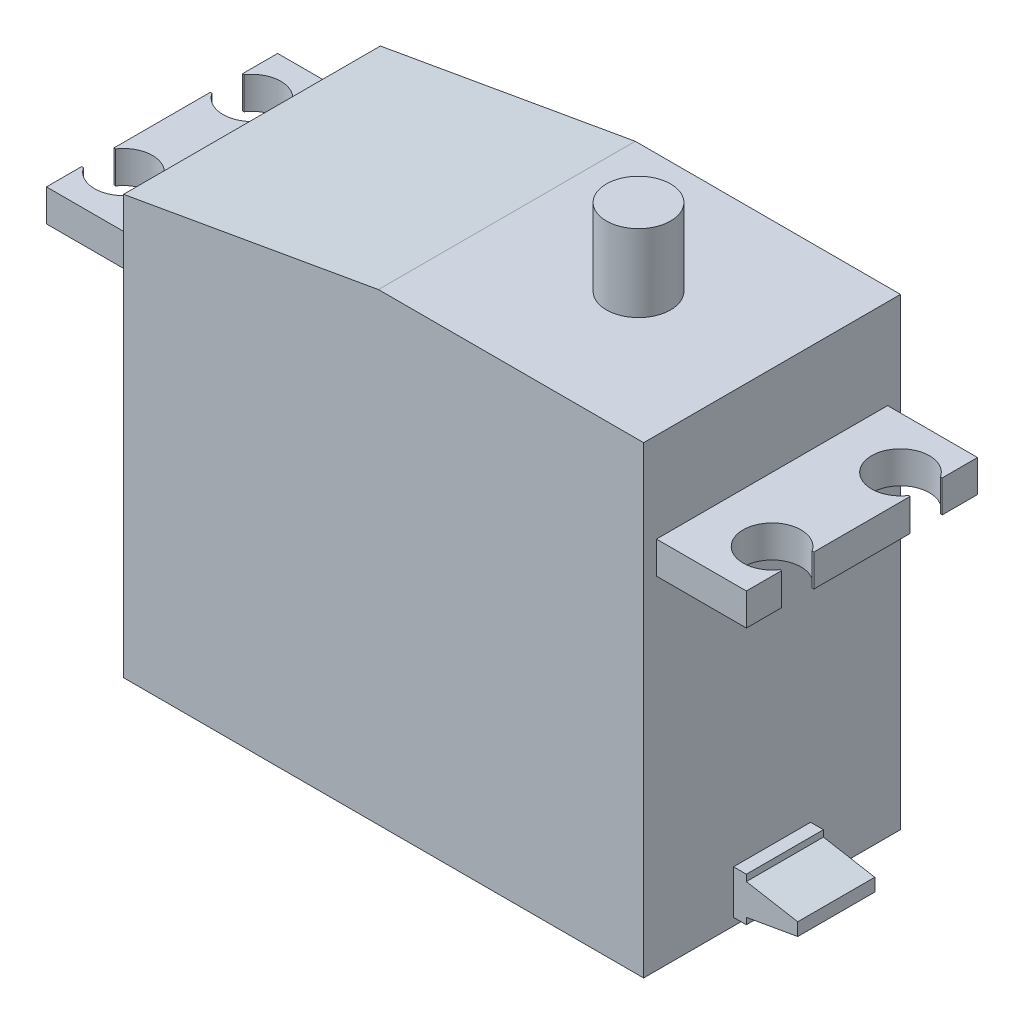
from build123d import *

# Parameters (mm, degrees)
SKETCH1_W           = 40.5
SKETCH1_H           = 36.1
BOSS_EXTRUDE1_DEPTH = 20
BOSS_EXTRUDE2_START = -1
SKETCH2_W           = 7
SKETCH2_H           = 2.5
BOSS_EXTRUDE2_DEPTH = 18
CUT_EXTRUDE1_REACH  = 61.187
SKETCH4_R           = 2.5
BOSS_EXTRUDE3_DEPTH = 6
BOSS_EXTRUDE4_START = -7
BOSS_EXTRUDE4_DEPTH = 6
CUT_EXTRUDE2_REACH  = 68.548


with BuildPart() as part:
    # Sketch1 → Boss-Extrude1 (new body)
    with BuildSketch(Plane.XY):
        with Locations((20.25, 18.05)):
            Rectangle(SKETCH1_W, SKETCH1_H)
    extrude(amount=BOSS_EXTRUDE1_DEPTH)

    # Sketch2 → Boss-Extrude2 (add)
    with BuildSketch(Plane.XY.offset(20).offset(BOSS_EXTRUDE2_START)):
        with Locations((-3.5, 27.85)):
            Rectangle(SKETCH2_W, SKETCH2_H)
        with Locations((44, 27.85)):
            Rectangle(SKETCH2_W, SKETCH2_H)
    extrude(amount=-BOSS_EXTRUDE2_DEPTH)

    # Sketch3 → Cut-Extrude1 (cut, up to next)
    with BuildSketch(Plane(origin=(0, 29.1, 0), x_dir=(1, 0, 0), z_dir=(0, 1, 0)), mode=Mode.PRIVATE) as cut_extrude1_sk1:
        with BuildLine():
            Line((-6.870828693, -3.75), (-7, -3.75))
            Line((-7, -3.75), (-7, -6.25))
            Line((-7, -6.25), (-6.870828693, -6.25))
            ThreePointArc((-6.870828693, -6.25), (-2.75, -5), (-6.870828693, -3.75))
        make_face()
    cut_extrude1_tool1 = extrude(cut_extrude1_sk1.sketch, amount=-CUT_EXTRUDE1_REACH, mode=Mode.PRIVATE) & part.part
    # Sketch3 → Cut-Extrude1 (cut, up to next)
    with BuildSketch(Plane(origin=(0, 29.1, 0), x_dir=(1, 0, 0), z_dir=(0, 1, 0)), mode=Mode.PRIVATE) as cut_extrude1_sk2:
        with BuildLine():
            Line((-7, -13.75), (-6.870828693, -13.75))
            ThreePointArc((-6.870828693, -13.75), (-2.75, -15), (-6.870828693, -16.25))
            Line((-6.870828693, -16.25), (-7, -16.25))
            Line((-7, -16.25), (-7, -13.75))
        make_face()
    cut_extrude1_tool2 = extrude(cut_extrude1_sk2.sketch, amount=-CUT_EXTRUDE1_REACH, mode=Mode.PRIVATE) & part.part
    # Sketch3 → Cut-Extrude1 (cut, up to next)
    with BuildSketch(Plane(origin=(0, 29.1, 0), x_dir=(1, 0, 0), z_dir=(0, 1, 0)), mode=Mode.PRIVATE) as cut_extrude1_sk3:
        with BuildLine():
            Line((47.370828693, -16.25), (47.5, -16.25))
            Line((47.5, -16.25), (47.5, -13.75))
            Line((47.5, -13.75), (47.370828693, -13.75))
            ThreePointArc((47.370828693, -13.75), (43.25, -15), (47.370828693, -16.25))
        make_face()
    cut_extrude1_tool3 = extrude(cut_extrude1_sk3.sketch, amount=-CUT_EXTRUDE1_REACH, mode=Mode.PRIVATE) & part.part
    # Sketch3 → Cut-Extrude1 (cut, up to next)
    with BuildSketch(Plane(origin=(0, 29.1, 0), x_dir=(1, 0, 0), z_dir=(0, 1, 0)), mode=Mode.PRIVATE) as cut_extrude1_sk4:
        with BuildLine():
            Line((47.5, -6.25), (47.370828693, -6.25))
            ThreePointArc((47.370828693, -6.25), (43.25, -5), (47.370828693, -3.75))
            Line((47.370828693, -3.75), (47.5, -3.75))
            Line((47.5, -3.75), (47.5, -6.25))
        make_face()
    cut_extrude1_tool4 = extrude(cut_extrude1_sk4.sketch, amount=-CUT_EXTRUDE1_REACH, mode=Mode.PRIVATE) & part.part
    add(cut_extrude1_tool1.solids().sort_by_distance((-4.956552, 29.1, 5))[0], mode=Mode.SUBTRACT)
    add(cut_extrude1_tool2.solids().sort_by_distance((-4.956552, 29.1, 15))[0], mode=Mode.SUBTRACT)
    add(cut_extrude1_tool3.solids().sort_by_distance((45.456552, 29.1, 15))[0], mode=Mode.SUBTRACT)
    add(cut_extrude1_tool4.solids().sort_by_distance((45.456552, 29.1, 5))[0], mode=Mode.SUBTRACT)

    # Sketch4 → Boss-Extrude3 (add)
    with BuildSketch(Plane(origin=(0, 36.1, 0), x_dir=(1, 0, 0), z_dir=(0, 1, 0))):
        with Locations(Location((30.1, -10, 0), (0, 0, 90))):
            Circle(SKETCH4_R)
    extrude(amount=BOSS_EXTRUDE3_DEPTH)

    # Sketch5 → Boss-Extrude4 (add)
    with BuildSketch(Plane.XY.offset(20).offset(BOSS_EXTRUDE4_START)):
        Polygon((40.5, 4), (41.5, 4), (41.5, 3.5), (45.5, 2.794692077), (45.5, 1.794692077), (41.5, 1.089384154), (41.5, 0.589384154), (40.5, 0.589384154), align=None)
    extrude(amount=-BOSS_EXTRUDE4_DEPTH)

    # Sketch6 → Cut-Extrude2 (cut, up to next)
    with BuildSketch(Plane.XY.offset(20), mode=Mode.PRIVATE) as cut_extrude2_sk1:
        Polygon((0, 32.6), (19.849486369, 36.1), (0, 36.1), align=None)
    cut_extrude2_tool1 = extrude(cut_extrude2_sk1.sketch, amount=-CUT_EXTRUDE2_REACH, mode=Mode.PRIVATE) & part.part
    add(cut_extrude2_tool1.solids().sort_by_distance((6.616495, 34.933333, 20))[0], mode=Mode.SUBTRACT)


solid = part.part
